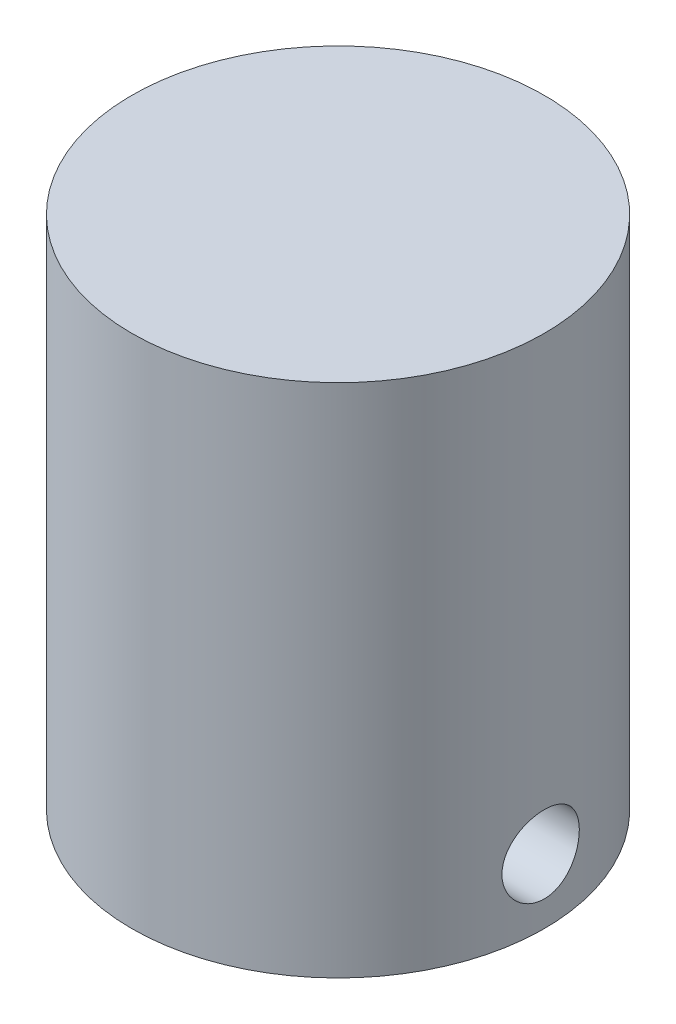
from build123d import *

# Parameters (mm, degrees)
SKETCH3_R               = 8
BOSS_EXTRUDE1_DEPTH     = 20
SKETCH4_R               = 4
CUT_EXTRUDE1_DEPTH      = 12
CUT_EXTRUDE2_DEPTH      = 23.978250586
CUT_EXTRUDE2_DEPTH_BACK = 23.978250586
SKETCH5_R               = 1.5


with BuildPart() as part:
    # Sketch3 → Boss-Extrude1 (new body)
    with BuildSketch(Plane(origin=(0, 0, 0), x_dir=(1, 0, 0), z_dir=(0, 1, 0))):
        with Locations(Location((0, 0, 0), (0, 0, 270))):
            Circle(SKETCH3_R)
    extrude(amount=BOSS_EXTRUDE1_DEPTH)

    # Sketch4 → Cut-Extrude1 (cut)
    with BuildSketch(Plane.XZ):
        with Locations(Location((0, 0, 0), (0, 0, 270))):
            Circle(SKETCH4_R)
    extrude(amount=-CUT_EXTRUDE1_DEPTH, mode=Mode.SUBTRACT)

    # Sketch5 → Cut-Extrude2 (cut, two sides: drawn at the far end of the back side and taken through both)
    with BuildSketch(Plane(origin=(0, 0, 0), x_dir=(0, 0, -1), z_dir=(1, 0, 0)).offset(-CUT_EXTRUDE2_DEPTH_BACK)):
        with Locations((0, 2.5)):
            Circle(SKETCH5_R)
    extrude(amount=CUT_EXTRUDE2_DEPTH + CUT_EXTRUDE2_DEPTH_BACK, mode=Mode.SUBTRACT)


solid = part.part
